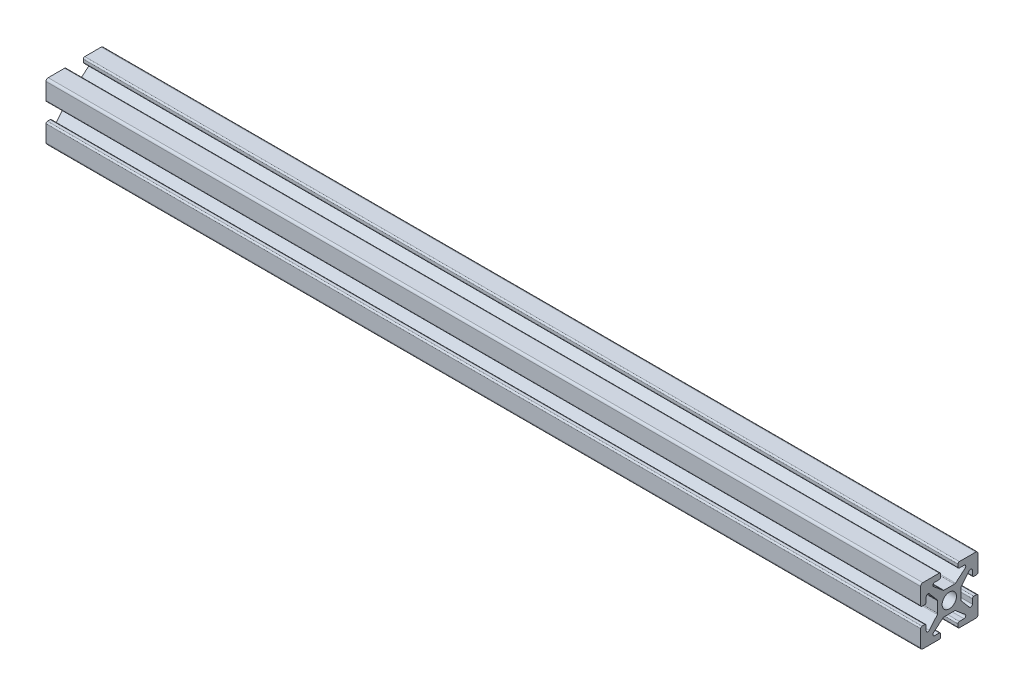
from build123d import *

# Parameters (mm, degrees)
BOSS_EXTRUDE1_START = -76.2
BOSS_EXTRUDE1_DEPTH = 152.4


with BuildPart() as part:
    # Sketch4 → Boss-Extrude1 (new body)
    with BuildSketch(Plane(origin=(0, 0, 0), x_dir=(0, 0, -1), z_dir=(1, 0, 0)).offset(BOSS_EXTRUDE1_START)):
        with BuildLine():
            Line((0, 1.2573), (0, 2.0193))
            Line((0, 2.0193), (0.92659956, 2.0193))
            ThreePointArc((0.92659956, 2.0193), (1.013472677, 2.034618074), (1.089867613, 2.078724711))
            Line((1.089867613, 2.078724711), (2.759770219, 3.479939372))
            ThreePointArc((2.759770219, 3.479939372), (2.851556384, 3.822490003), (2.561056801, 4.0259))
            Line((2.561056801, 4.0259), (1.7526, 4.0259))
            ThreePointArc((1.7526, 4.0259), (1.572994878, 4.100294878), (1.4986, 4.2799))
            Line((1.4986, 4.2799), (1.4986, 4.746))
            ThreePointArc((1.4986, 4.746), (1.572994878, 4.925605122), (1.7526, 5))
            Line((1.7526, 5), (4.619, 5))
            ThreePointArc((4.619, 5), (4.888407684, 4.888407684), (5, 4.619))
            Line((5, 4.619), (5, 1.7526))
            ThreePointArc((5, 1.7526), (4.925605122, 1.572994878), (4.746, 1.4986))
            Line((4.746, 1.4986), (4.2799, 1.4986))
            ThreePointArc((4.2799, 1.4986), (4.100294878, 1.572994878), (4.0259, 1.7526))
            Line((4.0259, 1.7526), (4.0259, 2.561056801))
            ThreePointArc((4.0259, 2.561056801), (3.822490003, 2.851556384), (3.479939372, 2.759770219))
            Line((3.479939372, 2.759770219), (2.078724711, 1.089867613))
            ThreePointArc((2.078724711, 1.089867613), (2.034618074, 1.013472677), (2.0193, 0.92659956))
            Line((2.0193, 0.92659956), (2.0193, 0))
            Line((2.0193, 0), (1.2573, 0))
            ThreePointArc((1.2573, 0), (0.889045356, 0.889045356), (0, 1.2573))
        make_face()
    extrude(amount=BOSS_EXTRUDE1_DEPTH)

    # Mirror1: part across plane


with BuildPart() as part_1:
    add(part.part)
    add(part.part.mirror(Plane.ZX))

    # Mirror2: part across plane


with BuildPart() as part_2:
    add(part_1.part)
    add(part_1.part.mirror(Plane.XY))


solid = part_2.part
